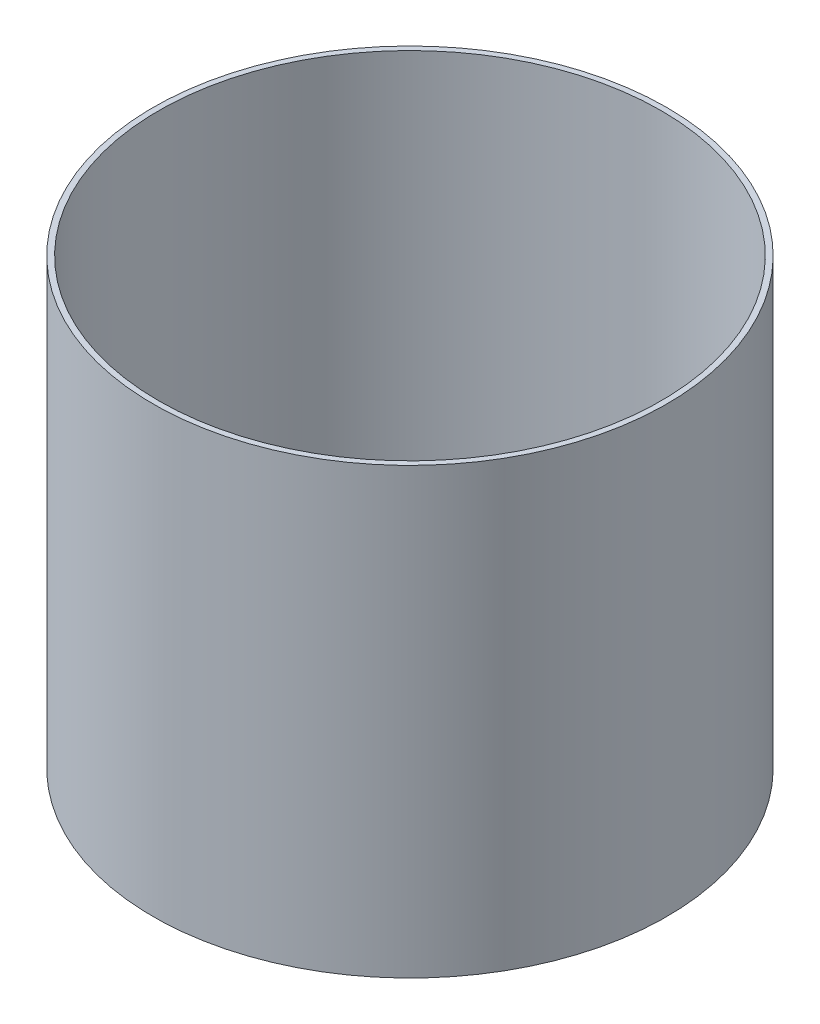
from build123d import *

# Parameters (mm, degrees)
F_10_0_10_DIAMETER_HOLE1_D     = 10
F_10_0_10_DIAMETER_HOLE1_DEPTH = 6.469611049


with BuildPart() as part:
    # Sketch1 → Revolve1 (revolve)
    with BuildSketch(Plane.XY, mode=Mode.PRIVATE) as revolve1_sk:
        Polygon((-85.775111633, 73.127284053), (-86.775111633, 73.127284053), (-86.775111633, -5.543553009), (-115, 1), (-115, 0), (-85.775111633, -6.775389285), align=None)
    revolve(revolve1_sk.sketch.rotate(Axis((-132, 75, 0), (0, -1, 0)), 270), axis=Axis((-132, 75, 0), (0, -1, 0)))

    # Ø10.0 (10) Diameter Hole1
    with Locations(Plane(origin=(0, -0.305778236, 0), x_dir=(1, 0, 0), z_dir=(0, 1, 0))):
        with Locations((-132.499951782, -35.99652828), (-160.645933369, -22.445632867), (-167.600149202, 8.008626739), (-148.125932919, 32.433571901), (-116.887766582, 32.436720734), (-97.408626586, 8.015702102), (-104.356702649, -22.439958866)):
            Hole(F_10_0_10_DIAMETER_HOLE1_D / 2, depth=F_10_0_10_DIAMETER_HOLE1_DEPTH)


solid = part.part
